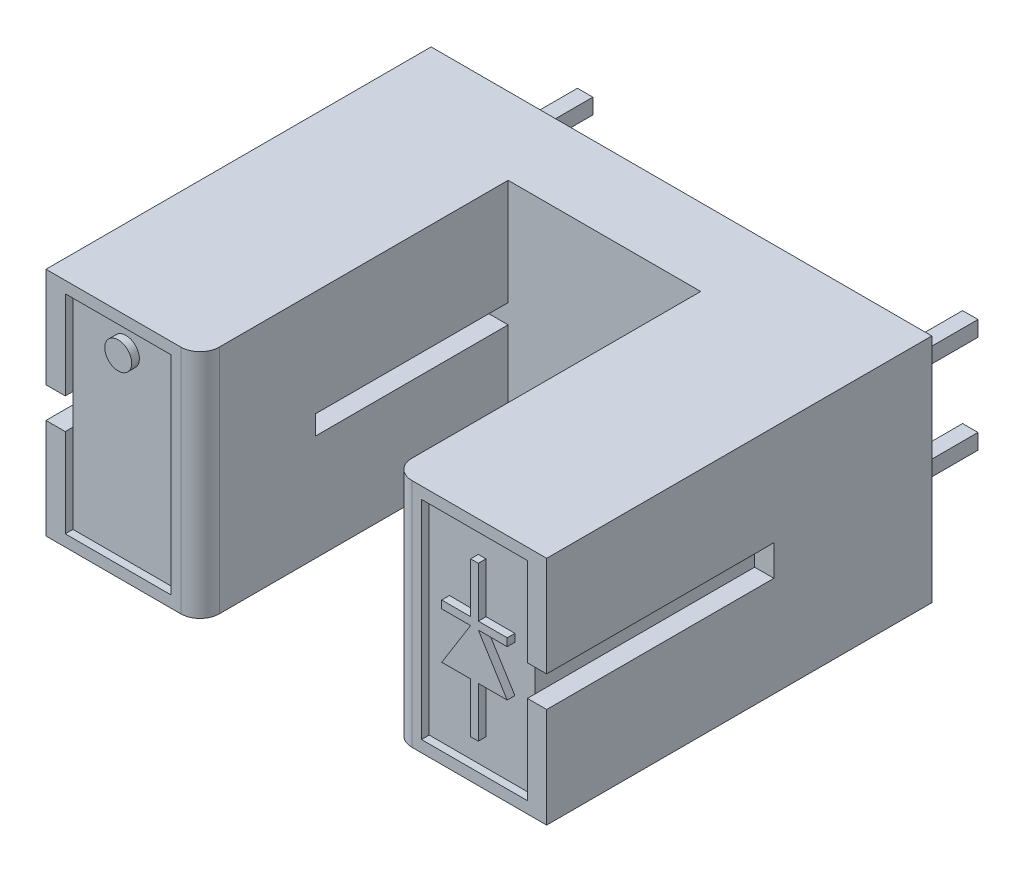
from build123d import *

# Parameters (mm, degrees)
EXTRUDE_1_DEPTH      = 3
EXTRUDE_1_DEPTH_BACK = 3
FILLET_1_R           = 0.5
SKETCH_3_W           = 5.9
SKETCH_3_H           = 0.8
CUT_EXTRUDE_1_DEPTH  = 0.5
SKETCH_4_W           = 5
SKETCH_4_H           = 0.5
CUT_EXTRUDE_2_DEPTH  = 0.5
SKETCH_5_W           = 2.75
SKETCH_5_H           = 5.4
CUT_EXTRUDE_3_DEPTH  = 0.2
SKETCH_6_R           = 0.35
EXTRUDE_3_DEPTH      = 0.2
SKETCH_2_W           = 0.4
SKETCH_2_H           = 0.4
EXTRUDE_2_DEPTH      = 2.5


with BuildPart() as part:
    # Эскиз1 → Бобышка-Вытянуть1 (new, two sides: drawn at the far end of the back side and taken through both)
    with BuildSketch(Plane(origin=(0, 0, 0), x_dir=(1, 0, 0), z_dir=(0, 1, 0)).offset(-EXTRUDE_1_DEPTH_BACK)):
        Polygon((6.5, 0), (-6.5, 0), (-6.5, -10), (-2.5, -10), (-2.5, -2), (2.5, -2), (2.5, -10), (6.5, -10), align=None)
    extrude(amount=EXTRUDE_1_DEPTH + EXTRUDE_1_DEPTH_BACK)

    # Скругление1
    fillet_1_edges = [part.edges().sort_by_distance(p)[0] for p in [
        (2.5, 0, 10),
        (-2.5, 0, 10),
    ]]
    fillet(fillet_1_edges, radius=FILLET_1_R)

    # Эскиз3 → Вырез-Вытянуть1 (cut)
    with BuildSketch(Plane(origin=(6.5, 0, 0), x_dir=(0, 0, -1), z_dir=(1, 0, 0))):
        with Locations((-7.05, 0)):
            Rectangle(SKETCH_3_W, SKETCH_3_H)
    cut_extrude_1 = extrude(amount=-CUT_EXTRUDE_1_DEPTH, mode=Mode.SUBTRACT)

    # Эскиз4 → Вырез-Вытянуть2 (cut)
    with BuildSketch(Plane.ZY.offset(-2.5)):
        with Locations((4.5, 0)):
            Rectangle(SKETCH_4_W, SKETCH_4_H)
    cut_extrude_2 = extrude(amount=-CUT_EXTRUDE_2_DEPTH, mode=Mode.SUBTRACT)

    # Зеркальное отражение1: Вырез-Вытянуть1, Вырез-Вытянуть2 across plane
    add(cut_extrude_1.mirror(Plane(origin=(0, 0, 0), x_dir=(0, 0, 1), z_dir=(1, 0, 0))), mode=Mode.SUBTRACT)
    add(cut_extrude_2.mirror(Plane(origin=(0, 0, 0), x_dir=(0, 0, 1), z_dir=(1, 0, 0))), mode=Mode.SUBTRACT)

    # Эскиз5 → Вырез-Вытянуть3 (cut)
    with BuildSketch(Plane.XY.offset(10)):
        with Locations((-4.625, 0)):
            Rectangle(SKETCH_5_W, SKETCH_5_H)
        with Locations((4.625, 0)):
            Rectangle(SKETCH_5_W, SKETCH_5_H)
    extrude(amount=-CUT_EXTRUDE_3_DEPTH, mode=Mode.SUBTRACT)

    # Эскиз6 → Бобышка-Вытянуть3 (add)
    with BuildSketch(Plane.XY.offset(9.8)):
        with Locations(Location((-4.625, 2, 0), (0, 0, 180))):
            Circle(SKETCH_6_R)
        Polygon((4.725, -2), (4.725, -0.7), (5.475, -0.7), (4.725, 0.5), (5.475, 0.5), (5.475, 0.7), (4.725, 0.7), (4.725, 2), (4.525, 2), (4.525, 0.7), (3.775, 0.7), (3.775, 0.5), (4.525, 0.5), (3.775, -0.7), (4.525, -0.7), (4.525, -2), align=None)
    extrude(amount=EXTRUDE_3_DEPTH)

    # Эскиз2 → Бобышка-Вытянуть2 (add)
    with BuildSketch(Plane(origin=(0, 0, 0), x_dir=(-1, 0, 0), z_dir=(0, 0, -1))):
        with Locations((5, 1.27)):
            Rectangle(SKETCH_2_W, SKETCH_2_H)
        with Locations((-5, 1.27)):
            Rectangle(SKETCH_2_W, SKETCH_2_H)
        with Locations((5, -1.27)):
            Rectangle(SKETCH_2_W, SKETCH_2_H)
        with Locations((-5, -1.27)):
            Rectangle(SKETCH_2_W, SKETCH_2_H)
    extrude(amount=EXTRUDE_2_DEPTH)


solid = part.part
